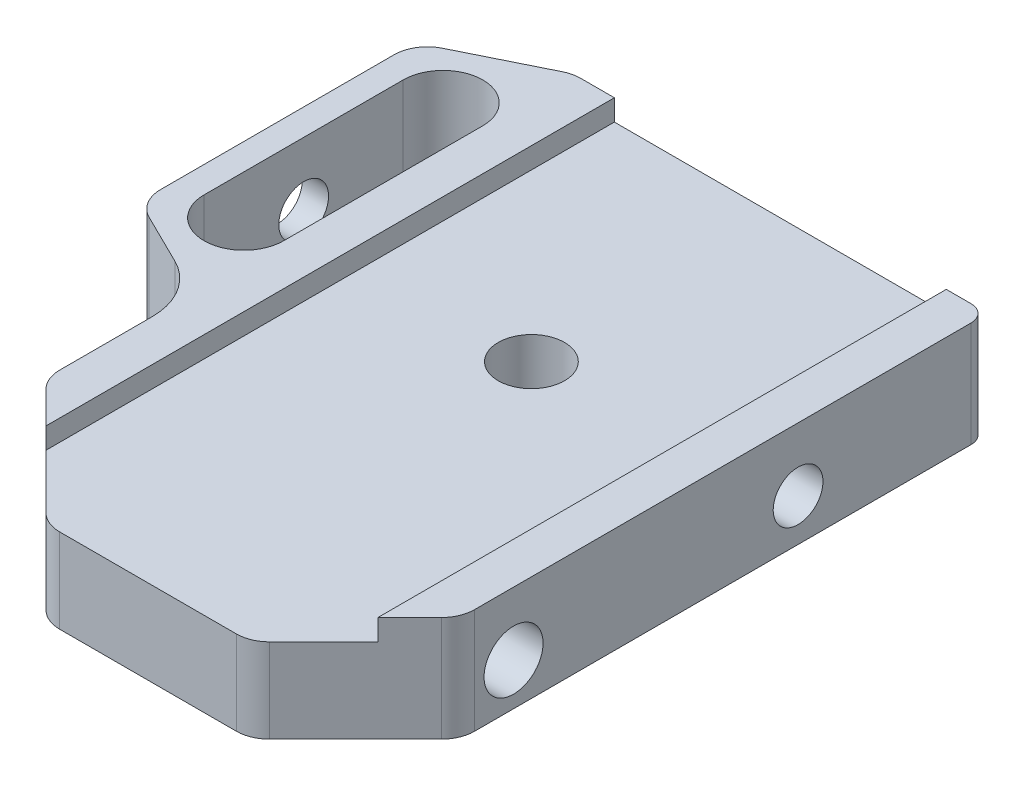
from build123d import *

# Parameters (mm, degrees)
BOSS_EXTRUDE1_DEPTH       = 1.27
SKETCH2_W                 = 6.38125
SKETCH2_H                 = 1.27
CUT_EXTRUDE1_DEPTH        = 8.89
BOSS_EXTRUDE2_DEPTH       = 5.08
BOSS_EXTRUDE3_DEPTH       = 1.27
CUT_EXTRUDE2_DEPTH        = 47.010134753
DRAFT1_ANGLE              = 26.24884537
F_6_CLEARANCE_HOLE1_D     = 4
F_3_CLEARANCE_HOLE1_D     = 3
F_3_CLEARANCE_HOLE1_DEPTH = 56.38125
F_5_CLEARANCE_HOLE1_D     = 3.556
FILLET1_R                 = 1.000000032
FILLET2_R                 = 2.000000064
FILLET3_R                 = 4.000000128


with BuildPart() as part:
    # Sketch1 → Boss-Extrude1 (new body)
    with BuildSketch(Plane(origin=(0, 6.35, 0), x_dir=(1, 0, 0), z_dir=(0, 1, 0))):
        Polygon((-6.38125, -3.146724382), (-6.38125, -31.75), (0, -31.75), (2.5, -34.25), (2.5, 0), (0, 0), align=None)
    extrude(amount=-BOSS_EXTRUDE1_DEPTH)

    # Sketch2 → Cut-Extrude1 (cut)
    with BuildSketch(Plane.XY.offset(31.75)):
        with Locations((-3.190625, 5.715)):
            Rectangle(SKETCH2_W, SKETCH2_H)
    extrude(amount=-CUT_EXTRUDE1_DEPTH, mode=Mode.SUBTRACT)

    # Sketch3 → Boss-Extrude2 (add)
    with BuildSketch(Plane.XZ.offset(-5.08)):
        Polygon((25, 0), (0, 0), (-6.38125, 3.146724382), (-6.38125, 22.86), (0, 22.86), (0, 31.75), (6.35, 38.1), (18.65, 38.1), (25, 31.75), align=None)
    extrude(amount=BOSS_EXTRUDE2_DEPTH)

    # Sketch4 → Boss-Extrude3 (add)
    with BuildSketch(Plane(origin=(0, 5.08, 0), x_dir=(-1, 0, 0), z_dir=(0, 1, 0))):
        Polygon((-25, 31.75), (-22.5, 34.25), (-22.5, 0), (-25, 0), align=None)
    extrude(amount=BOSS_EXTRUDE3_DEPTH)

    # Sketch5 → Cut-Extrude2 (cut, through all)
    with BuildSketch(Plane.XZ):
        with BuildLine():
            Line((-4.79375, 17.43), (-4.79375, 5.43))
            ThreePointArc((-4.79375, 5.43), (-2.396875, 3.033125), (0, 5.43))
            Line((0, 5.43), (0, 17.43))
            ThreePointArc((0, 17.43), (-2.396875, 19.826875), (-4.79375, 17.43))
        make_face()
    extrude(amount=-CUT_EXTRUDE2_DEPTH, mode=Mode.SUBTRACT)

    # Draft1
    draft1_faces = [part.faces().sort_by_distance(p)[0] for p in [
        (-3.190625, 3.175, 22.86),
    ]]
    draft(draft1_faces, Plane(origin=(0, 5.08, 22.86), x_dir=(0, -1, 0), z_dir=(-1, 0, 0)), DRAFT1_ANGLE)

    # #6 Clearance Hole1 (through all)
    with Locations(Plane(origin=(0, 5.08, 0), x_dir=(1, 0, 0), z_dir=(0, 1, 0))):
        with Locations((12.5, -15)):
            Hole(F_6_CLEARANCE_HOLE1_D / 2)

    # #3 Clearance Hole1
    with Locations(Plane.ZY.offset(6.38125)):
        with Locations((11.43, 2.54)):
            Hole(F_3_CLEARANCE_HOLE1_D / 2, depth=F_3_CLEARANCE_HOLE1_DEPTH)

    # #5 Clearance Hole1 (through all)
    with Locations(Plane.ZY):
        with Locations((28.575, 2.54)):
            Hole(F_5_CLEARANCE_HOLE1_D / 2)

    # Fillet1
    fillet1_edges = [part.edges().sort_by_distance(p)[0] for p in [
        (25, 3.175, 0),
    ]]
    fillet(fillet1_edges, radius=FILLET1_R)

    # Fillet2
    fillet2_edges = [part.edges().sort_by_distance(p)[0] for p in [
        (0, 3.175, 0),
        (0, 3.175, 31.75),
        (-6.38125, 3.175, 3.146724382),
        (-6.38125, 3.175, 19.713275618),
        (25, 3.175, 31.75),
        (18.65, 2.54, 38.1),
        (6.35, 2.54, 38.1),
    ]]
    fillet(fillet2_edges, radius=FILLET2_R)

    # Fillet3
    fillet3_edges = [part.edges().sort_by_distance(p)[0] for p in [
        (0, 3.175, 22.86),
    ]]
    fillet(fillet3_edges, radius=FILLET3_R)


solid = part.part
